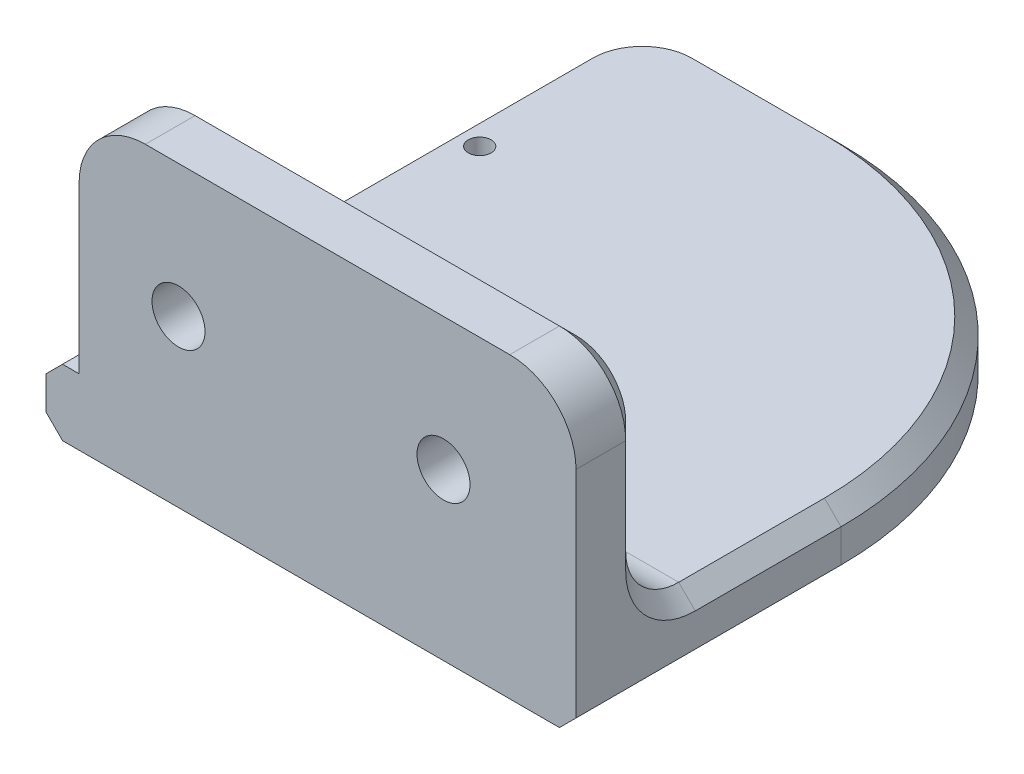
from build123d import *

# Parameters (mm, degrees)
BOSS_EXTRUDE1_DEPTH = 50.8
SKETCH2_R           = 2.54
CUT_EXTRUDE1_DEPTH  = 82.628996839
SKETCH3_R           = 1.0922
CUT_EXTRUDE2_DEPTH  = 82.628996839
FILLET2_R           = 31.75
SKETCH4_W           = 3.175
SKETCH4_H           = 22.225
CUT_EXTRUDE3_DEPTH  = 78.316302453
FILLET3_R           = 6.35
FILLET4_R           = 5.08
CHAMFER1_SIZE       = 1.5875


with BuildPart() as part:
    # Sketch1 → Boss-Extrude1 (new body)
    with BuildSketch(Plane(origin=(0, 0, 0), x_dir=(0, 0, -1), z_dir=(1, 0, 0))):
        Polygon((0, 0), (0, 28.575), (6.35, 28.575), (6.35, 6.35), (57.15, 6.35), (57.15, 0), align=None)
    extrude(amount=BOSS_EXTRUDE1_DEPTH)

    # Sketch2 → Cut-Extrude1 (cut, through all)
    with BuildSketch(Plane.XY):
        with Locations((12.7, 15.875)):
            Circle(SKETCH2_R)
        with Locations(Location((38.1, 15.875, 0), (0, 0, 270))):
            Circle(SKETCH2_R)
    extrude(amount=-CUT_EXTRUDE1_DEPTH, mode=Mode.SUBTRACT)

    # Sketch3 → Cut-Extrude2 (cut, through all)
    with BuildSketch(Plane.XZ):
        with Locations(Location((13.9065, -15.875, 0), (0, 0, 270))):
            Circle(SKETCH3_R)
        with Locations(Location((3.4925, -38.0746, 0), (0, 0, 270))):
            Circle(SKETCH3_R)
    extrude(amount=-CUT_EXTRUDE2_DEPTH, mode=Mode.SUBTRACT)

    # Fillet2
    fillet2_edges = [part.edges().sort_by_distance(p)[0] for p in [
        (50.8, 3.175, -57.15),
    ]]
    fillet(fillet2_edges, radius=FILLET2_R)

    # Sketch4 → Cut-Extrude3 (cut, through all)
    with BuildSketch(Plane(origin=(0, 0, -6.35), x_dir=(-1, 0, 0), z_dir=(0, 0, -1))):
        with Locations((-1.5875, 17.4625)):
            Rectangle(SKETCH4_W, SKETCH4_H)
    extrude(amount=-CUT_EXTRUDE3_DEPTH, mode=Mode.SUBTRACT)

    # Fillet3
    fillet3_edges = [part.edges().sort_by_distance(p)[0] for p in [
        (50.8, 28.575, -3.175),
        (3.175, 28.575, -3.175),
        (0, 3.175, -57.15),
    ]]
    fillet(fillet3_edges, radius=FILLET3_R)

    # Fillet4
    fillet4_edges = [part.edges().sort_by_distance(p)[0] for p in [
        (26.9875, 6.35, -6.35),
    ]]
    fillet(fillet4_edges, radius=FILLET4_R)

    # Chamfer1
    chamfer1_edges = [part.edges().sort_by_distance(p)[0] for p in [
        (50.8, 6.35, -18.415),
        (12.7, 6.35, -57.15),
        (41.500640303, 6.35, -47.850640303),
        (12.7, 0, -57.15),
        (41.500640303, 0, -47.850640303),
        (50.8, 0, -12.7),
        (26.9875, 28.575, -6.35),
        (3.175, 16.8275, -6.35),
        (5.034871939, 26.715128061, -6.35),
        (48.940128061, 26.715128061, -6.35),
        (0, 6.35, -25.4),
        (1.859871939, 6.35, -55.290128061),
        (1.859871939, 0, -55.290128061),
        (50.8, 16.8275, -6.35),
        (3.175, 7.837897552, -7.837897552),
        (50.8, 7.837897552, -7.837897552),
        (0, 0, -25.4),
    ]]
    chamfer(chamfer1_edges, length=CHAMFER1_SIZE)


solid = part.part
